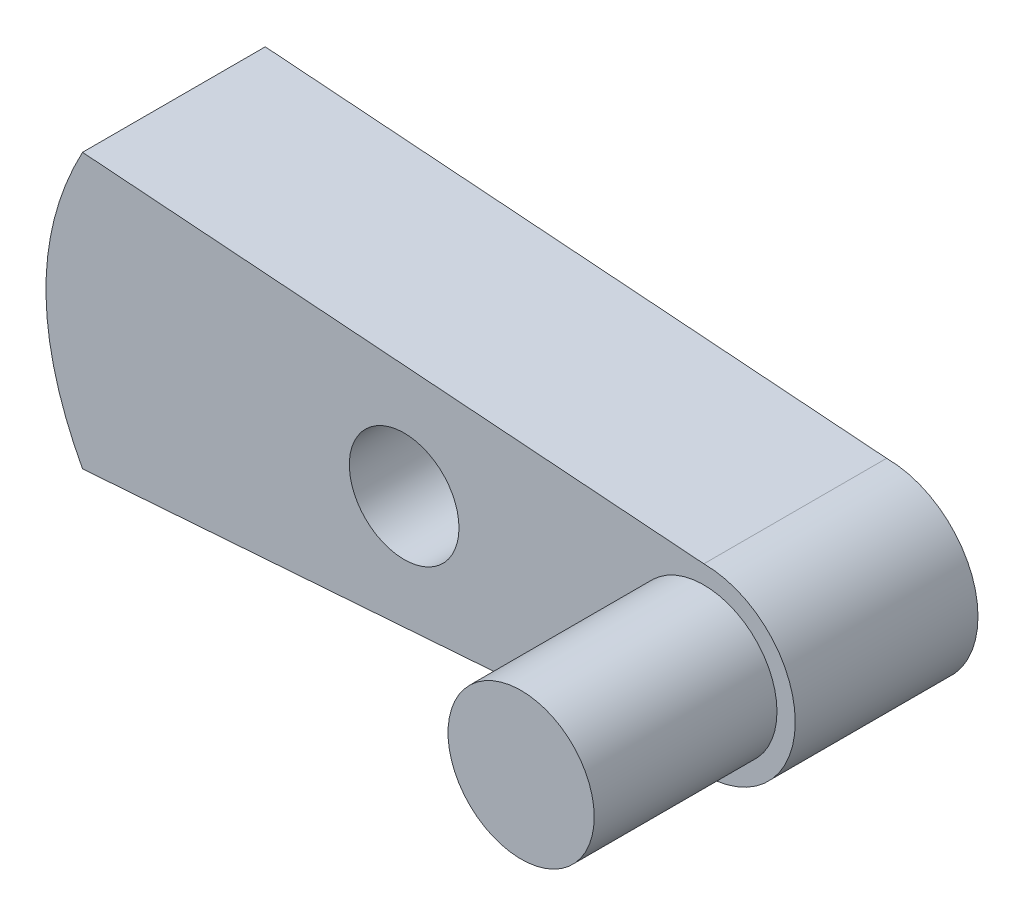
from build123d import *

# Parameters (mm, degrees)
BOSS_EXTRUDE1_DEPTH     = 12.7
SKETCH2_R               = 5.08
BOSS_EXTRUDE2_DEPTH     = 25.4
CUT_EXTRUDE1_DEPTH      = 6.858
CUT_EXTRUDE1_DEPTH_BACK = 12.954
SKETCH3_R               = 3.81


with BuildPart() as part:
    # Sketch1 → Boss-Extrude1 (new body)
    with BuildSketch(Plane.XY):
        with BuildLine():
            Line((-5.436566547, 31.20219701), (37.743433453, 28.02719701))
            ThreePointArc((37.743433453, 28.02719701), (44.093433453, 21.67719701), (37.743433453, 15.32719701))
            Line((37.743433453, 15.32719701), (-5.436566547, 12.15219701))
            add(Edge.make_bspline(
                [(-5.436566547, 12.15219701), (-10.516566547, 21.67719701), (-5.436566547, 31.20219701)],
                knots=[0, 0, 0, 1, 1, 1], degree=2))
        make_face()
    extrude(amount=BOSS_EXTRUDE1_DEPTH)

    # Sketch2 → Boss-Extrude2 (add)
    with BuildSketch(Plane.XY):
        with Locations((37.743433453, 21.67719701)):
            Circle(SKETCH2_R)
    extrude(amount=BOSS_EXTRUDE2_DEPTH)

    # Sketch3 → Cut-Extrude1 (cut, two sides: drawn at the far end of the back side and taken through both)
    with BuildSketch(Plane.XY.offset(12.7).offset(-CUT_EXTRUDE1_DEPTH_BACK)):
        with Locations((16.915433453, 21.67719701)):
            Circle(SKETCH3_R)
    extrude(amount=CUT_EXTRUDE1_DEPTH + CUT_EXTRUDE1_DEPTH_BACK, mode=Mode.SUBTRACT)


solid = part.part
